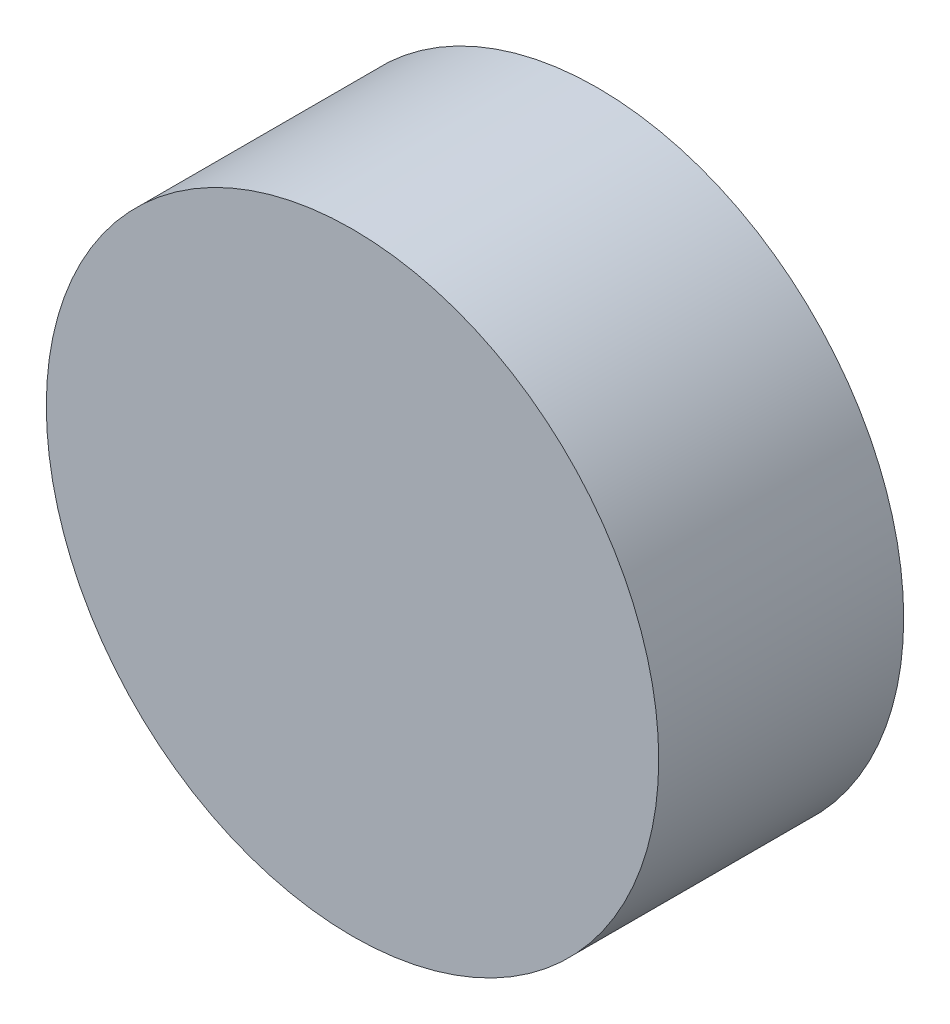
from build123d import *

# Parameters (mm, degrees)
SKETCH1_R           = 20
BOSS_EXTRUDE1_DEPTH = 16


with BuildPart() as part:
    # Sketch1 → Boss-Extrude1 (new body)
    with BuildSketch(Plane.XY):
        Circle(SKETCH1_R)
    extrude(amount=BOSS_EXTRUDE1_DEPTH)


solid = part.part
